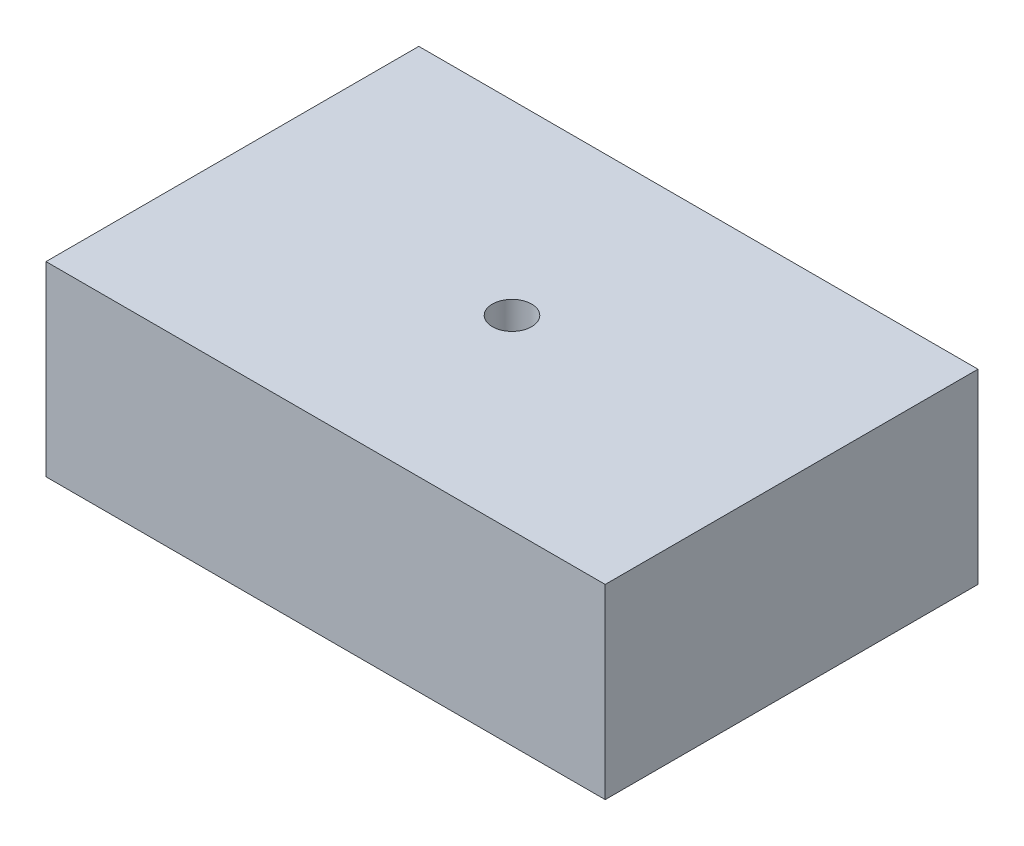
from build123d import *

# Parameters (mm, degrees)
SKETCH1_W           = 30
SKETCH1_H           = 20
SKETCH1_R           = 1.055
BOSS_EXTRUDE1_DEPTH = 10


with BuildPart() as part:
    # Sketch1 → Boss-Extrude1 (new body)
    with BuildSketch(Plane(origin=(0, 0, 0), x_dir=(1, 0, 0), z_dir=(0, 1, 0))):
        Rectangle(SKETCH1_W, SKETCH1_H)
        with Locations(Location((0, 0, 0), (0, 0, 270))):
            Circle(SKETCH1_R, mode=Mode.SUBTRACT)
    extrude(amount=BOSS_EXTRUDE1_DEPTH)


solid = part.part
